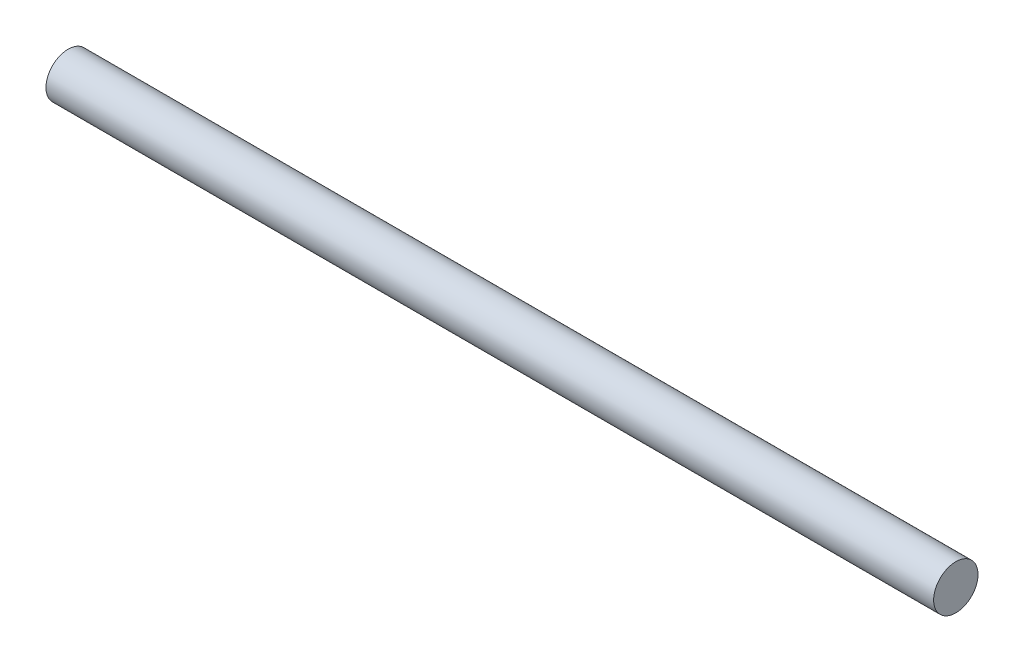
from build123d import *

# Parameters (mm, degrees)
ESQUISSE1_R        = 2.5
BOSS_EXTRU_1_DEPTH = 100


with BuildPart() as part:
    # Esquisse1 → Boss.-Extru.1 (new body)
    with BuildSketch(Plane(origin=(0, 0, 0), x_dir=(0, 0, -1), z_dir=(1, 0, 0))):
        Circle(ESQUISSE1_R)
    extrude(amount=BOSS_EXTRU_1_DEPTH)


solid = part.part
